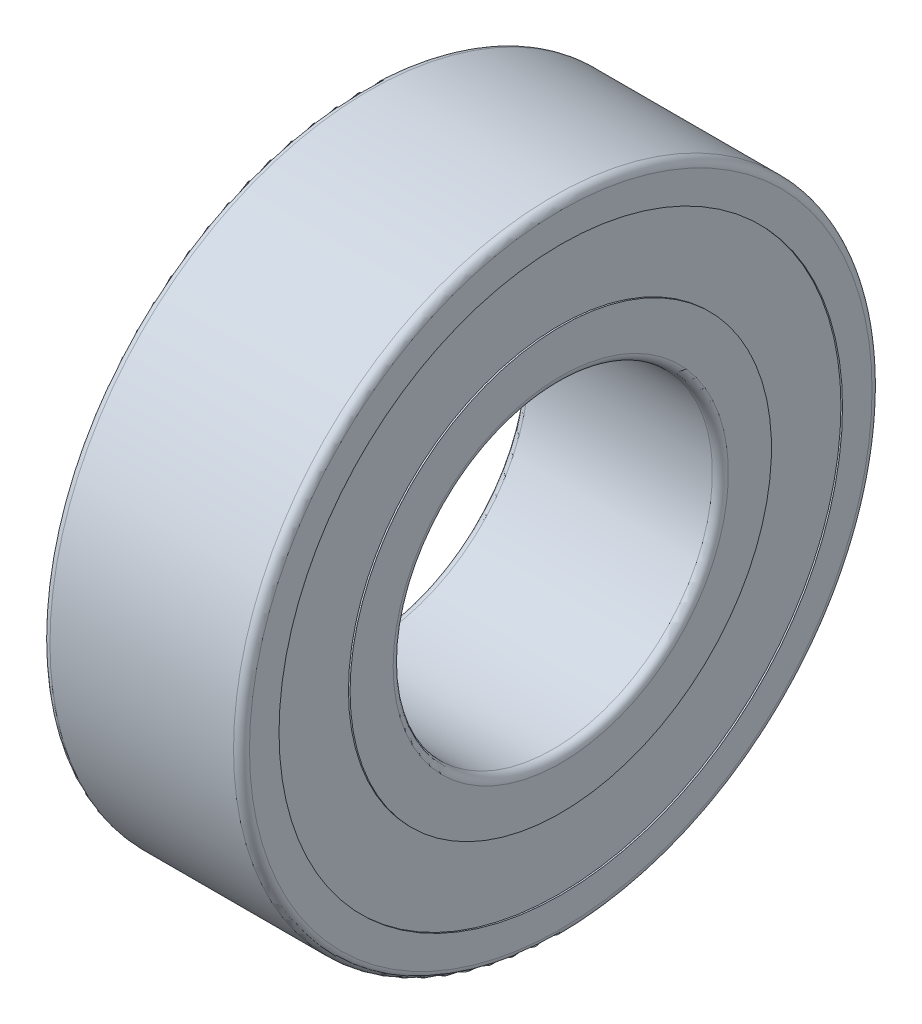
from build123d import *


with BuildPart() as part:
    # Sketch1 → Revolve1 (revolve)
    with BuildSketch(Plane.XY, mode=Mode.PRIVATE) as revolve1_sk:
        with BuildLine():
            Line((0.2, 4), (4.8, 4))
            ThreePointArc((4.8, 4), (4.941421356, 4.058578644), (5, 4.2))
            Line((5, 4.2), (5, 5.28))
            Line((5, 5.28), (4.96, 5.28))
            Line((4.96, 5.28), (4.96, 7.06))
            Line((4.96, 7.06), (5, 7.06))
            Line((5, 7.06), (5, 7.8))
            ThreePointArc((5, 7.8), (4.941421356, 7.941421356), (4.8, 8))
            Line((4.8, 8), (0.2, 8))
            ThreePointArc((0.2, 8), (0.058578644, 7.941421356), (0, 7.8))
            Line((0, 7.8), (0, 7.06))
            Line((0, 7.06), (0.04, 7.06))
            Line((0.04, 7.06), (0.04, 5.28))
            Line((0.04, 5.28), (0, 5.28))
            Line((0, 5.28), (0, 4.2))
            ThreePointArc((0, 4.2), (0.058578644, 4.058578644), (0.2, 4))
        make_face()
    revolve(revolve1_sk.sketch.rotate(Axis((50, 0, 0), (-1, 0, 0)), 270), axis=Axis((50, 0, 0), (-1, 0, 0)))


solid = part.part
